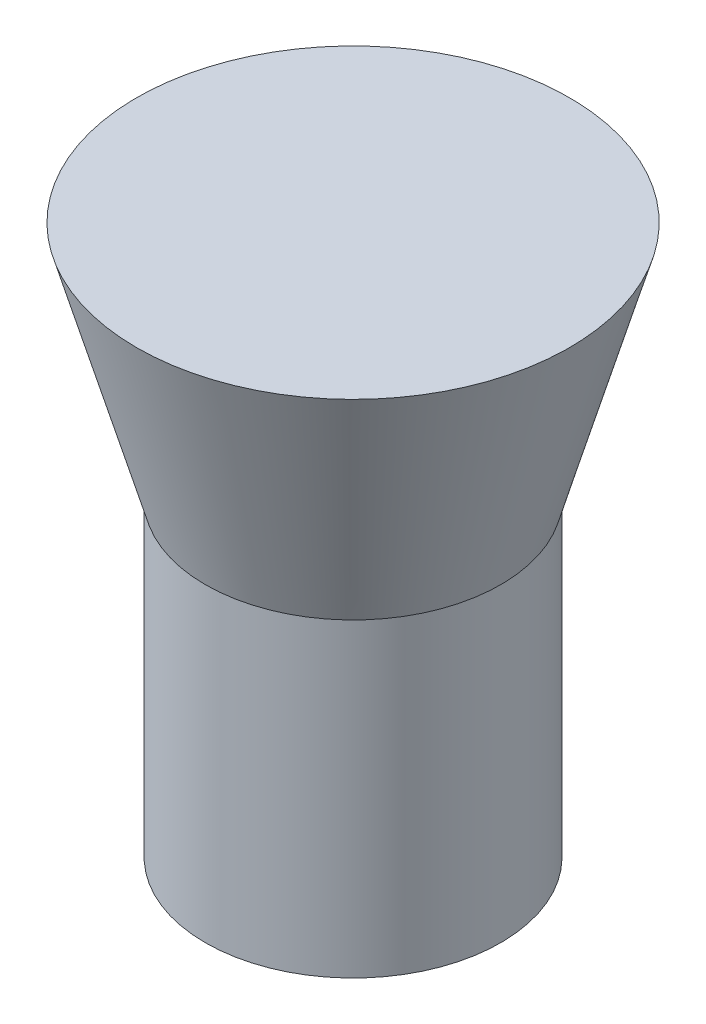
from build123d import *

# Parameters (mm, degrees)
SKETCH1_R           = 2.15
BOSS_EXTRUDE1_DEPTH = 8
SKETCH2_R           = 3.15
BOSS_EXTRUDE2_DEPTH = 4.5
BOSS_EXTRUDE2_DRAFT = -16


with BuildPart() as part:
    # Sketch1 → Boss-Extrude1 (new body)
    with BuildSketch(Plane(origin=(0, 0, 0), x_dir=(1, 0, 0), z_dir=(0, 1, 0))):
        with Locations(Location((0, 0, 0), (0, 0, 270))):
            Circle(SKETCH1_R)
    extrude(amount=BOSS_EXTRUDE1_DEPTH)


with BuildPart() as boss_extrude2_tool:
    # Sketch2 → Boss-Extrude2 (with draft: the straight prism first)
    with BuildSketch(Plane(origin=(0, 8, 0), x_dir=(1, 0, 0), z_dir=(0, 1, 0))):
        Circle(SKETCH2_R)
    extrude(amount=-BOSS_EXTRUDE2_DEPTH)
    # Boss-Extrude2: the draft: its side faces are tilted about the plane it starts from
    boss_extrude2_sides = [boss_extrude2_tool.faces().sort_by_distance(p)[0] for p in [
        (-3.15, 5.75, 0),
    ]]
    draft(boss_extrude2_sides, Plane(origin=(0, 8, 0), x_dir=(1, 0, 0), z_dir=(0, 1, 0)), BOSS_EXTRUDE2_DRAFT)


with BuildPart() as part_1:
    add(part.part)

    # Boss-Extrude2: add boss_extrude2_tool
    add(boss_extrude2_tool.part)


solid = part_1.part
